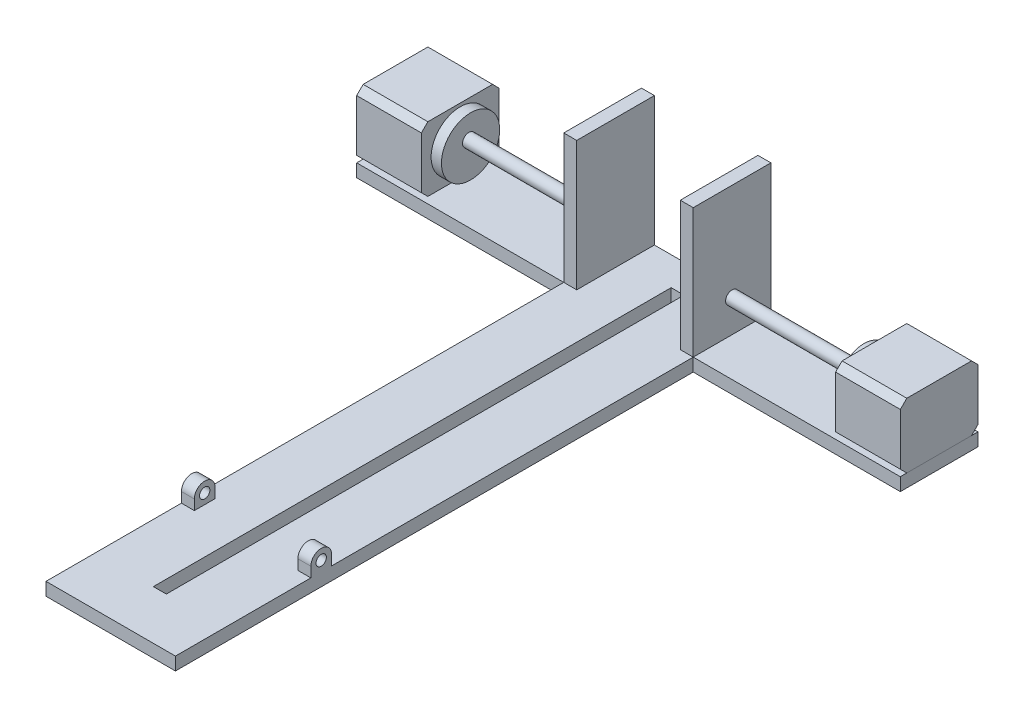
from build123d import *

# Parameters (mm, degrees)
SKETCH_1_W          = 100
SKETCH_1_H          = 10
EXTRUDE_1_DEPTH     = 460
SKETCH_2_W          = 10
SKETCH_2_H          = 400
CUT_EXTRUDE_1_DEPTH = 460
SKETCH_4_R          = 4
EXTRUDE_2_DEPTH     = 10
EXTRUDE_START       = -10
SKETCH_5_W          = 10
SKETCH_5_H          = 60
EXTRUDE_3_DEPTH     = 100
EXTRUDE_3_2_DEPTH   = 100
SKETCH_6_W          = 160
SKETCH_6_H          = 60
EXTRUDE_4_DEPTH     = 10
SKETCH_7_W          = 50
SKETCH_7_H          = 60
EXTRUDE_5_DEPTH     = 50
EXTRUDE_5_2_DEPTH   = 50
CHAMFER_1_SIZE      = 5
CHAMFER_2_SIZE      = 5
SKETCH_8_R          = 20.121485443
EXTRUDE_6_DEPTH     = 8
SKETCH_9_R          = 22.5
EXTRUDE_7_DEPTH     = 8
SKETCH_10_R         = 5
EXTRUDE_8_DEPTH     = 102
SKETCH_11_R         = 5
EXTRUDE_9_DEPTH     = 108


with BuildPart() as part:
    # 草图1 → 凸台-拉伸1 (new body)
    with BuildSketch(Plane.XY):
        Rectangle(SKETCH_1_W, SKETCH_1_H)
    extrude(amount=EXTRUDE_1_DEPTH)

    # 草图2 → 切除-拉伸1 (cut)
    with BuildSketch(Plane(origin=(0, 5, 0), x_dir=(1, 0, 0), z_dir=(0, 1, 0))):
        with Locations((0, -222.049931505)):
            Rectangle(SKETCH_2_W, SKETCH_2_H)
    extrude(amount=-CUT_EXTRUDE_1_DEPTH, mode=Mode.SUBTRACT)

    # 草图4 → 凸台-拉伸2 (add)
    with BuildSketch(Plane.ZY.offset(50)):
        with BuildLine():
            ThreePointArc((355.396917132, 12.798688849), (347.396917132, 20.798688849), (339.396917132, 12.798688849))
            Line((339.396917132, 12.798688849), (339.396917132, 5))
            Line((339.396917132, 5), (346.520803495, 5))
            Line((346.520803495, 5), (355.396917132, 5))
            Line((355.396917132, 5), (355.396917132, 12.798688849))
        make_face()
        with Locations((347.396917132, 12.798688849)):
            Circle(SKETCH_4_R, mode=Mode.SUBTRACT)
    extrude_2 = extrude(amount=-EXTRUDE_2_DEPTH)

    # 镜向1: 凸台-拉伸2 across plane
    add(extrude_2.mirror(Plane(origin=(0, 0, 0), x_dir=(0, 0, 1), z_dir=(1, 0, 0))))



with BuildPart() as body_2:
    # 草图5 → 凸台-拉伸3 (new body)
    with BuildSketch(Plane.XZ.offset(5).offset(EXTRUDE_START)):
        with Locations((-45, 30)):
            Rectangle(SKETCH_5_W, SKETCH_5_H)
    extrude(amount=-EXTRUDE_3_DEPTH)


with BuildPart() as body_3:
    # 草图5 → Extrude 3 2 (new body)
    with BuildSketch(Plane.XZ.offset(5).offset(EXTRUDE_START)):
        with Locations((45, 30)):
            Rectangle(SKETCH_5_W, SKETCH_5_H)
    extrude(amount=-EXTRUDE_3_2_DEPTH)


with BuildPart() as part_1:
    add(part.part)

    add(body_2.part)  # 凸台-拉伸4 merges body 2

    add(body_3.part)  # 凸台-拉伸4 merges body 3
    # 草图6 → 凸台-拉伸4 (add)
    with BuildSketch(Plane(origin=(0, 5, 0), x_dir=(1, 0, 0), z_dir=(0, 1, 0))):
        with Locations((130, -30)):
            Rectangle(SKETCH_6_W, SKETCH_6_H)
        with Locations((-130, -30)):
            Rectangle(SKETCH_6_W, SKETCH_6_H)
    extrude(amount=-EXTRUDE_4_DEPTH)

    # 草图11 → 凸台-拉伸9 (add)
    with BuildSketch(Plane(origin=(-152, 0, 0), x_dir=(0, 0, -1), z_dir=(1, 0, 0))):
        with Locations((-31.241708383, 35)):
            Circle(SKETCH_11_R)
    extrude(amount=EXTRUDE_9_DEPTH)


with BuildPart() as body_2_2:
    # 草图7 → 凸台-拉伸5 (new body)
    with BuildSketch(Plane(origin=(0, 5, 0), x_dir=(1, 0, 0), z_dir=(0, 1, 0))):
        with Locations((-185, -30)):
            Rectangle(SKETCH_7_W, SKETCH_7_H)
    extrude(amount=EXTRUDE_5_DEPTH)

    # 倒角1
    chamfer_1_edges = [body_2_2.edges().sort_by_distance(p)[0] for p in [
        (-185, 55, 0),
        (-185, 5, 0),
        (-185, 5, 60),
        (-185, 55, 60),
    ]]
    chamfer(chamfer_1_edges, length=CHAMFER_1_SIZE)


with BuildPart() as body_3_2:
    # 草图7 → Extrude 5 2 (new body)
    with BuildSketch(Plane(origin=(0, 5, 0), x_dir=(1, 0, 0), z_dir=(0, 1, 0))):
        with Locations((185, -30)):
            Rectangle(SKETCH_7_W, SKETCH_7_H)
    extrude(amount=EXTRUDE_5_2_DEPTH)

    # 倒角2
    chamfer_2_edges = [body_3_2.edges().sort_by_distance(p)[0] for p in [
        (185, 55, 60),
        (185, 5, 60),
        (185, 5, 0),
        (185, 55, 0),
    ]]
    chamfer(chamfer_2_edges, length=CHAMFER_2_SIZE)


with BuildPart() as body_4:
    # 草图8 → 凸台-拉伸6 (new body)
    with BuildSketch(Plane.ZY.offset(-160)):
        with Locations((30, 30)):
            Circle(SKETCH_8_R)
    extrude(amount=EXTRUDE_6_DEPTH)


with BuildPart() as body_5:
    # 草图9 → 凸台-拉伸7 (new body)
    with BuildSketch(Plane(origin=(-160, 0, 0), x_dir=(0, 0, -1), z_dir=(1, 0, 0))):
        with Locations((-30, 30)):
            Circle(SKETCH_9_R)
    extrude(amount=EXTRUDE_7_DEPTH)


with BuildPart() as body_6:
    # 草图10 → 凸台-拉伸8 (new body)
    with BuildSketch(Plane.ZY.offset(-152)):
        with Locations(Location((30, 30, 0), (0, 0, 180))):
            Circle(SKETCH_10_R)
    extrude(amount=EXTRUDE_8_DEPTH)


solid = Compound([part_1.part, body_2_2.part, body_3_2.part, body_4.part, body_5.part, body_6.part])
